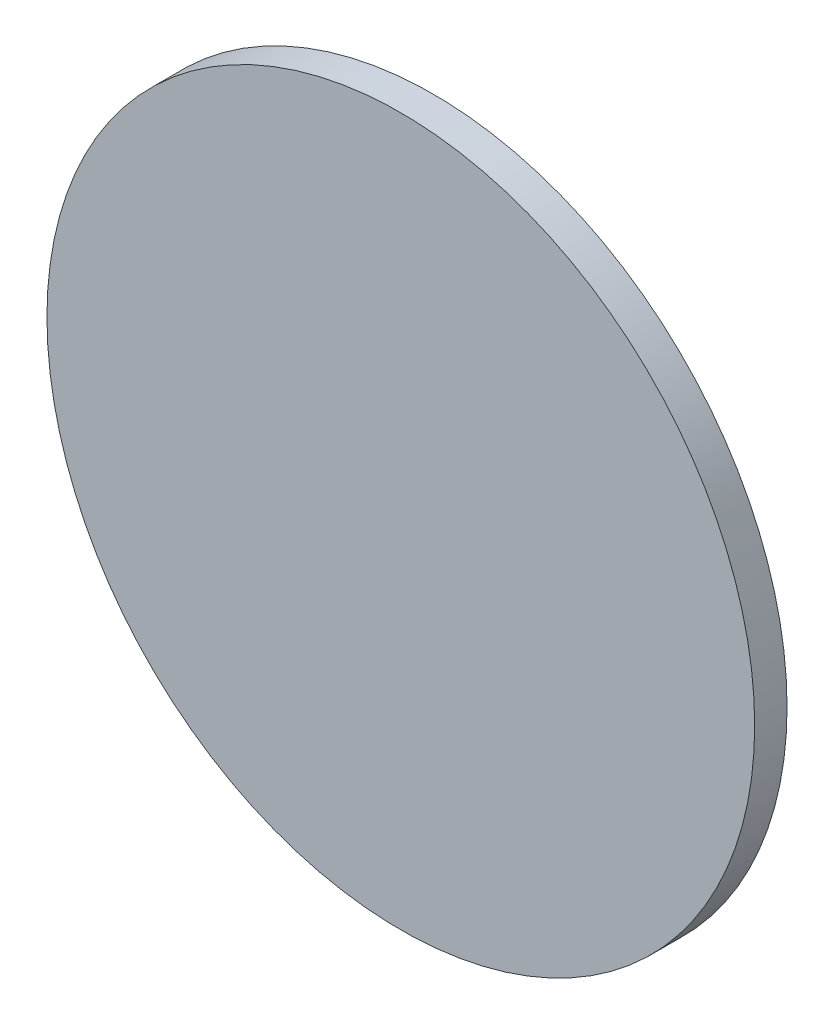
from build123d import *

# Parameters (mm, degrees)
SKETCH1_R           = 17.5
BOSS_EXTRUDE1_DEPTH = 1.6


with BuildPart() as part:
    # Sketch1 → Boss-Extrude1 (new body)
    with BuildSketch(Plane(origin=(0, 0, -930.4), x_dir=(-1, 0, 0), z_dir=(0, 0, -1))):
        Circle(SKETCH1_R)
    extrude(amount=BOSS_EXTRUDE1_DEPTH)


solid = part.part
